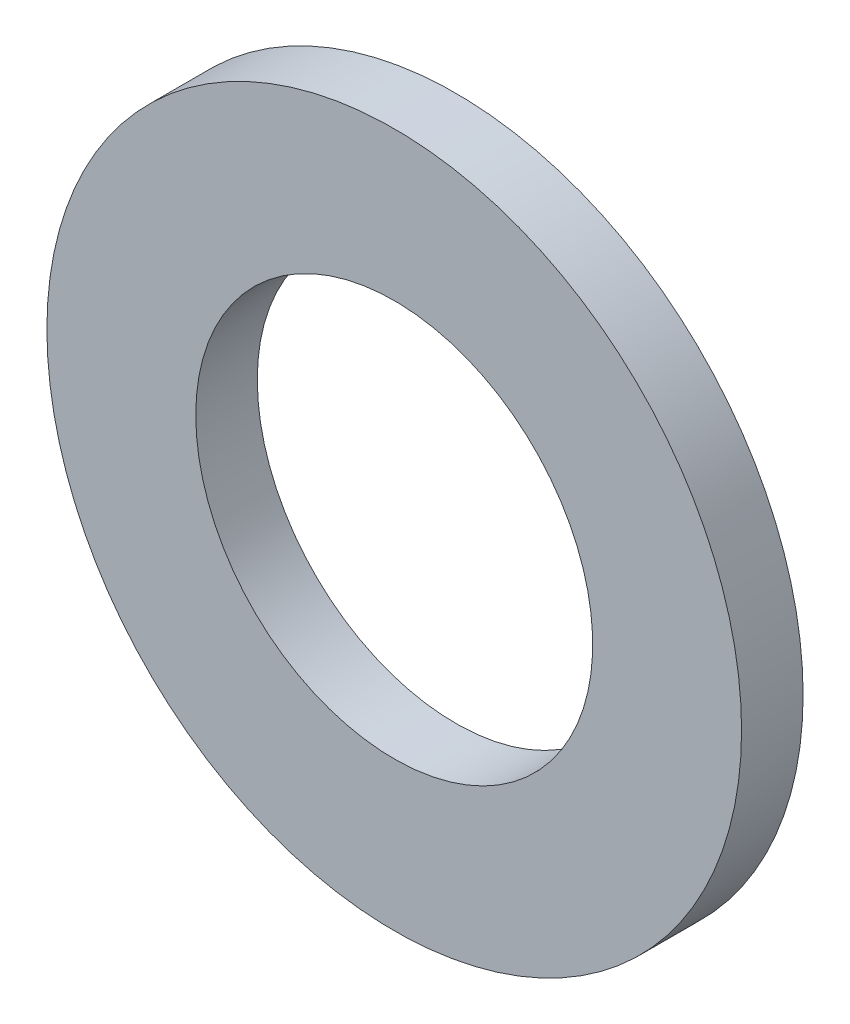
from build123d import *

# Parameters (mm, degrees)
SKETCH_1_R      = 17.5
SKETCH_1_R_2    = 10
EXTRUDE_1_DEPTH = 3.1


with BuildPart() as part:
    # 草图1 → 凸台-拉伸1 (new body)
    with BuildSketch(Plane.XY):
        with Locations(Location((0, 0, 0), (0, 0, 180))):
            Circle(SKETCH_1_R)
        with Locations(Location((0, 0, 0), (0, 0, 180))):
            Circle(SKETCH_1_R_2, mode=Mode.SUBTRACT)
    extrude(amount=EXTRUDE_1_DEPTH)


solid = part.part
